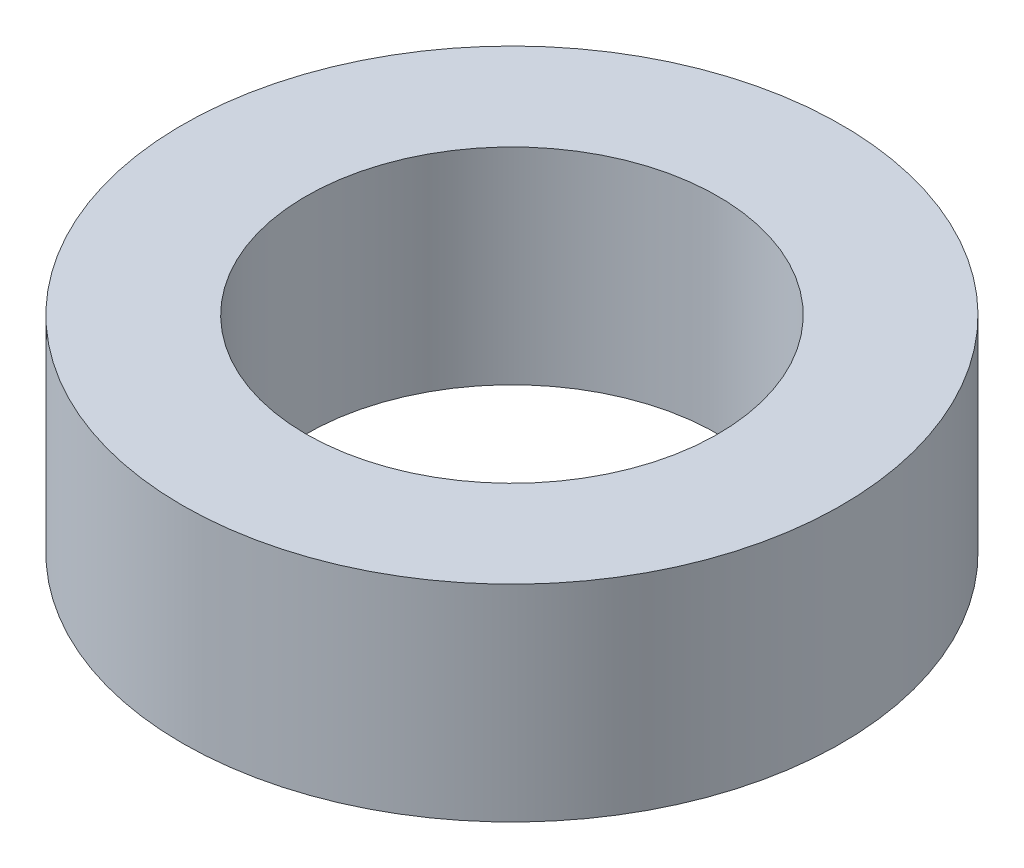
from build123d import *

# Parameters (mm, degrees)
SKETCH1_R           = 4
SKETCH1_R_2         = 2.5
BOSS_EXTRUDE1_DEPTH = 1.25


with BuildPart() as part:
    # Sketch1 → Boss-Extrude1 (new, symmetric)
    with BuildSketch(Plane(origin=(0, 0, 0), x_dir=(1, 0, 0), z_dir=(0, 1, 0))):
        with Locations(Location((0, 0, 0), (0, 0, 270))):
            Circle(SKETCH1_R)
        with Locations(Location((0, 0, 0), (0, 0, 270))):
            Circle(SKETCH1_R_2, mode=Mode.SUBTRACT)
    extrude(amount=BOSS_EXTRUDE1_DEPTH, both=True)


solid = part.part
